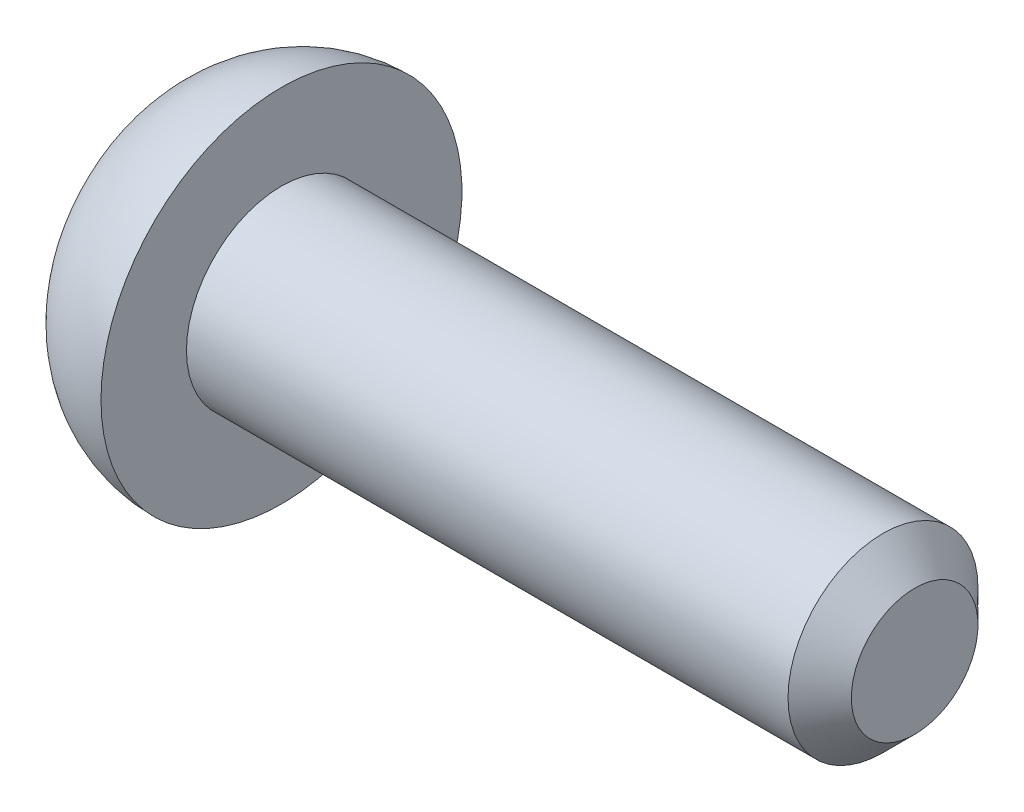
from build123d import *

# Parameters (mm, degrees)
CHAMFER1_SIZE      = 0.5
CUT_EXTRUDE1_DEPTH = 1


with BuildPart() as part:
    # Sketch2 → Revolve1 (revolve)
    with BuildSketch(Plane(origin=(0, 0, 0), x_dir=(1, 0, 0), z_dir=(0, 1, 0)), mode=Mode.PRIVATE) as revolve1_sk:
        with BuildLine():
            Line((0, 0), (0, 1.5))
            Line((0, 1.5), (-10, 1.5))
            Line((-10, 1.5), (-10, 2.85))
            ThreePointArc((-10, 2.85), (-10.917065968, 2.639177072), (-11.65, 2.049038106))
            Line((-11.65, 2.049038106), (-11.65, 0))
            Line((-11.65, 0), (0, 0))
        make_face()
    revolve(revolve1_sk.sketch.rotate(Axis((-11.65, 0, 0), (1, 0, 0)), 180), axis=Axis((-11.65, 0, 0), (1, 0, 0)))

    # Chamfer1
    chamfer1_edges = [part.edges().sort_by_distance(p)[0] for p in [
        (0, 0, -1.5),
    ]]
    chamfer(chamfer1_edges, length=CHAMFER1_SIZE)

    # Sketch4 → Cut-Extrude1 (cut)
    with BuildSketch(Plane.ZY.offset(11.65)):
        with BuildLine():
            ThreePointArc((-1.342027284, 0.090739778), (-0.883315009, 0.509982158), (-0.749596595, 1.116859832))
            ThreePointArc((-0.749596595, 1.116859832), (-0.7, 1.212435565), (-0.592430689, 1.20759961))
            ThreePointArc((-0.592430689, 1.20759961), (0, 1.019964317), (0.592430689, 1.20759961))
            ThreePointArc((0.592430689, 1.20759961), (0.7, 1.212435565), (0.749596595, 1.116859832))
            ThreePointArc((0.749596595, 1.116859832), (0.883315009, 0.509982158), (1.342027284, 0.090739778))
            ThreePointArc((1.342027284, 0.090739778), (1.4, 0), (1.342027284, -0.090739778))
            ThreePointArc((1.342027284, -0.090739778), (0.883315009, -0.509982158), (0.749596595, -1.116859832))
            ThreePointArc((0.749596595, -1.116859832), (0.7, -1.212435565), (0.592430689, -1.20759961))
            ThreePointArc((0.592430689, -1.20759961), (0, -1.019964317), (-0.592430689, -1.20759961))
            ThreePointArc((-0.592430689, -1.20759961), (-0.7, -1.212435565), (-0.749596595, -1.116859832))
            ThreePointArc((-0.749596595, -1.116859832), (-0.883315009, -0.509982158), (-1.342027284, -0.090739778))
            ThreePointArc((-1.342027284, -0.090739778), (-1.4, 0), (-1.342027284, 0.090739778))
        make_face()
    extrude(amount=-CUT_EXTRUDE1_DEPTH, mode=Mode.SUBTRACT)


solid = part.part
